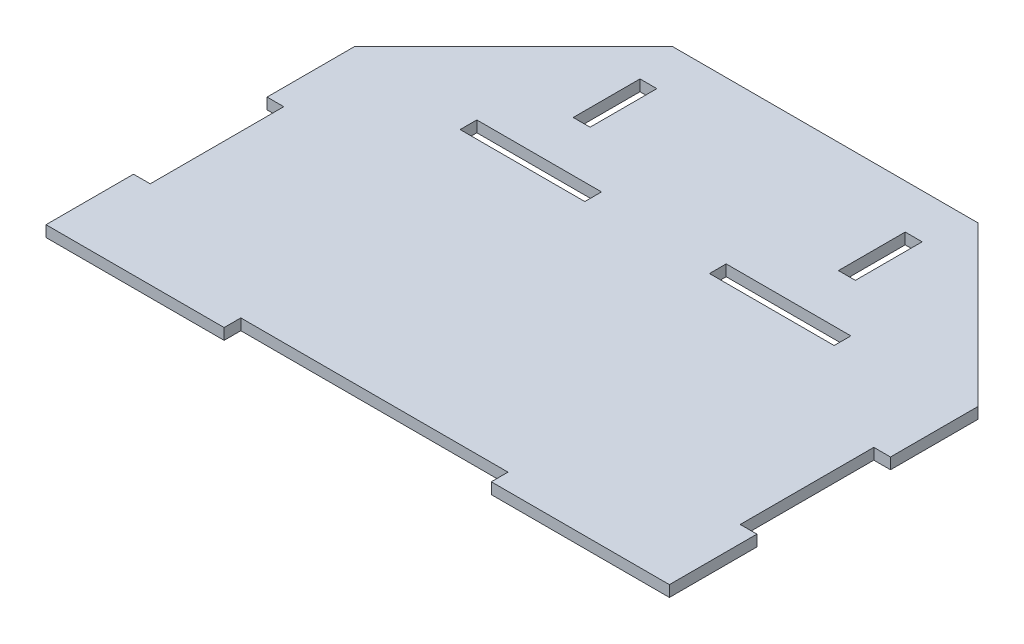
from build123d import *

# Parameters (mm, degrees)
BOSS_EXTRUDE1_DEPTH = 6.35
SKETCH2_W           = 71.12
SKETCH2_H           = 9.525
CUT_EXTRUDE1_DEPTH  = 223.34069578
SKETCH3_W           = 9.652
SKETCH3_H           = 38.1
SKETCH3_W_2         = 9.62146782
CUT_EXTRUDE2_DEPTH  = 6.35


with BuildPart() as part:
    # Sketch1 → Boss-Extrude1 (new body)
    with BuildSketch(Plane(origin=(0, 0, 0), x_dir=(1, 0, 0), z_dir=(0, 1, 0))):
        Polygon((-177.8, -7.239), (-177.8, 42.672), (-87.122, 133.35), (87.122, 133.35), (177.8, 42.672), (177.8, -7.239), (168.275, -7.239), (168.275, -83.439), (177.8, -83.439), (177.8, -133.35), (76.2, -133.35), (76.2, -123.825), (-76.2, -123.825), (-76.2, -133.35), (-177.8, -133.35), (-177.8, -83.439), (-168.275, -83.439), (-168.275, -7.239), align=None)
    extrude(amount=BOSS_EXTRUDE1_DEPTH)

    # Sketch2 → Cut-Extrude1 (cut, through all)
    with BuildSketch(Plane(origin=(0, 6.35, 0), x_dir=(1, 0, 0), z_dir=(0, 1, 0))):
        with Locations((71.12, 36.5125)):
            Rectangle(SKETCH2_W, SKETCH2_H)
        with Locations((-71.12, 36.5125)):
            Rectangle(SKETCH2_W, SKETCH2_H)
    extrude(amount=-CUT_EXTRUDE1_DEPTH, mode=Mode.SUBTRACT)

    # Sketch3 → Cut-Extrude2 (cut)
    with BuildSketch(Plane(origin=(0, 6.35, 0), x_dir=(1, 0, 0), z_dir=(0, 1, 0))):
        with Locations((75.702840569, 89.027)):
            Rectangle(SKETCH3_W, SKETCH3_H)
        with Locations((-75.596992051, 89.027)):
            Rectangle(SKETCH3_W_2, SKETCH3_H)
    extrude(amount=-CUT_EXTRUDE2_DEPTH, mode=Mode.SUBTRACT)


solid = part.part
